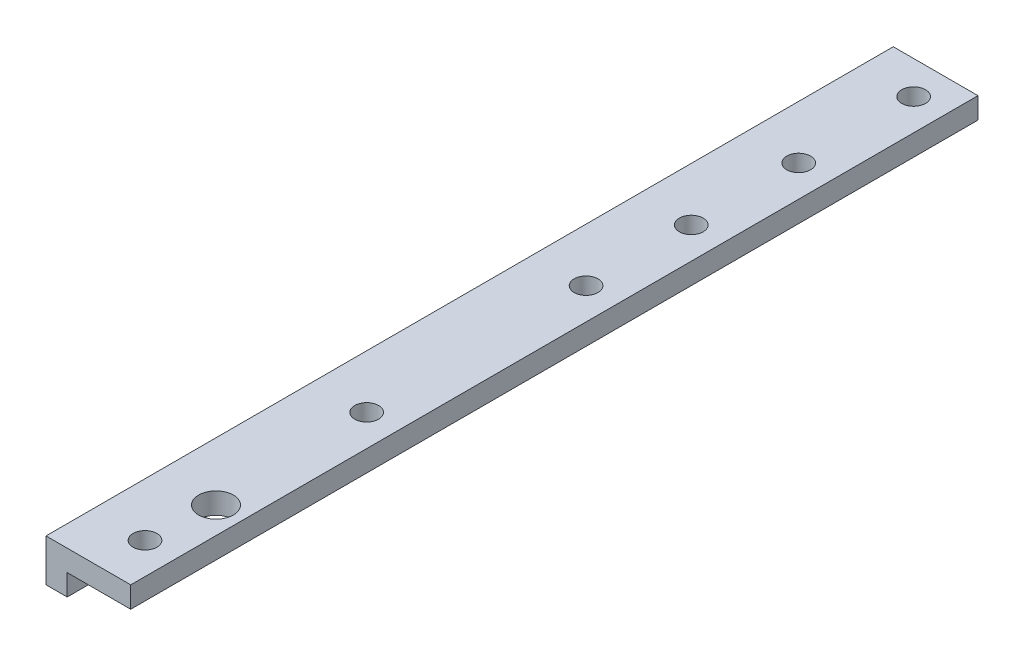
from build123d import *

# Parameters (mm, degrees)
BOSS_EXTRUDE1_DEPTH  = 160
SKETCH2_W            = 39.551056564
SKETCH2_H            = 2
CUT_EXTRUDE1_DEPTH   = 4
M4_CLEARANCE_HOLE1_D = 4.5
SKETCH5_R            = 3.275
CUT_EXTRUDE2_DEPTH   = 10


with BuildPart() as part:
    # Sketch1 → Boss-Extrude1 (new body)
    with BuildSketch(Plane.XY):
        Polygon((0, 0), (0, -10), (4, -10), (4, -4), (16, -4), (16, 0), align=None)
    extrude(amount=BOSS_EXTRUDE1_DEPTH)

    # Sketch2 → Cut-Extrude1 (cut)
    with BuildSketch(Plane(origin=(4, 0, 0), x_dir=(0, 0, -1), z_dir=(1, 0, 0))):
        with Locations((-140.224471718, -9)):
            Rectangle(SKETCH2_W, SKETCH2_H)
    extrude(amount=-CUT_EXTRUDE1_DEPTH, mode=Mode.SUBTRACT)

    # M4 Clearance Hole1 (through all)
    with Locations(Plane(origin=(0, -4, 0), x_dir=(-1, 0, 0), z_dir=(0, -1, 0))):
        with Locations((-10.072352995, -6.228090532), (-10.072352995, -27.937872474), (-10.072352995, -48.221464361), (-10.072352995, -68.087621842), (-10.072352995, -109.517546491), (-10.072352995, -151.376567413)):
            Hole(M4_CLEARANCE_HOLE1_D / 2)

    # Sketch5 → Cut-Extrude2 (cut)
    with BuildSketch(Plane.XZ.offset(4)):
        with Locations(Location((11, 138.897931951, 0), (0, 0, 270))):
            Circle(SKETCH5_R)
    extrude(amount=-CUT_EXTRUDE2_DEPTH, mode=Mode.SUBTRACT)


solid = part.part
